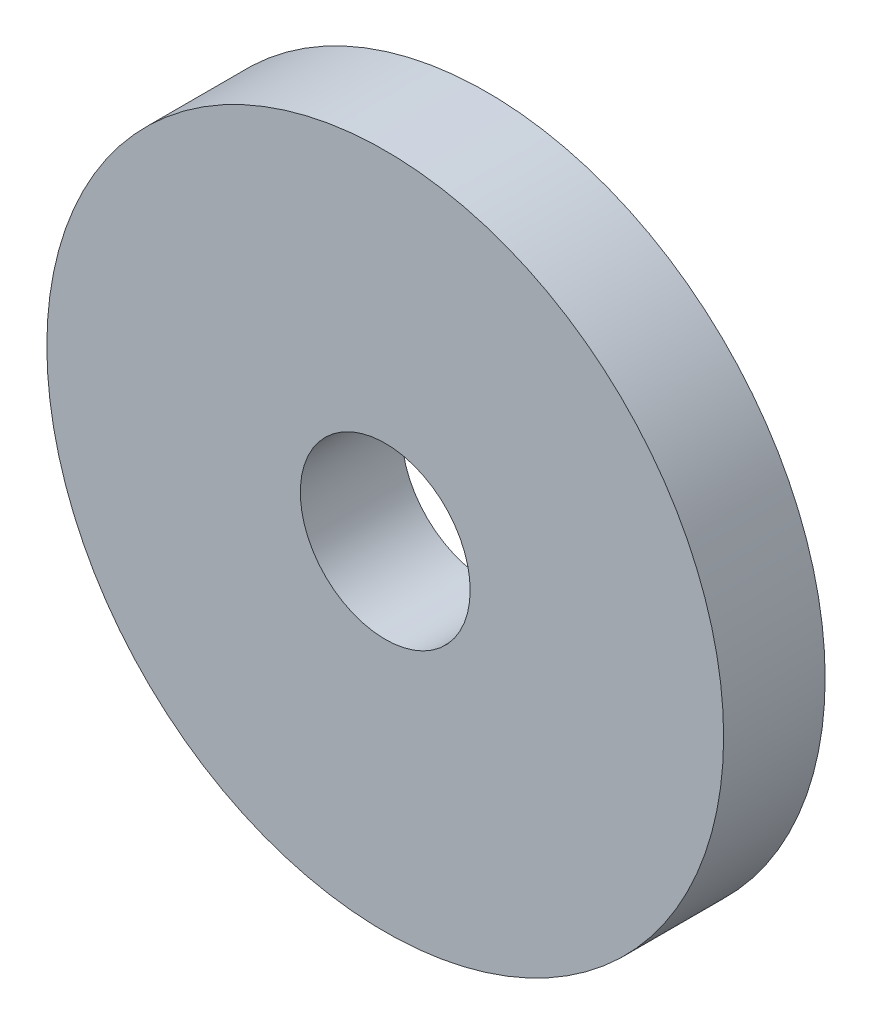
from build123d import *

# Parameters (mm, degrees)
SKETCH1_R           = 10
SKETCH1_R_2         = 2.51
BOSS_EXTRUDE1_DEPTH = 3


with BuildPart() as part:
    # Sketch1 → Boss-Extrude1 (new body)
    with BuildSketch(Plane.XY):
        Circle(SKETCH1_R)
        Circle(SKETCH1_R_2, mode=Mode.SUBTRACT)
    extrude(amount=BOSS_EXTRUDE1_DEPTH)


solid = part.part
